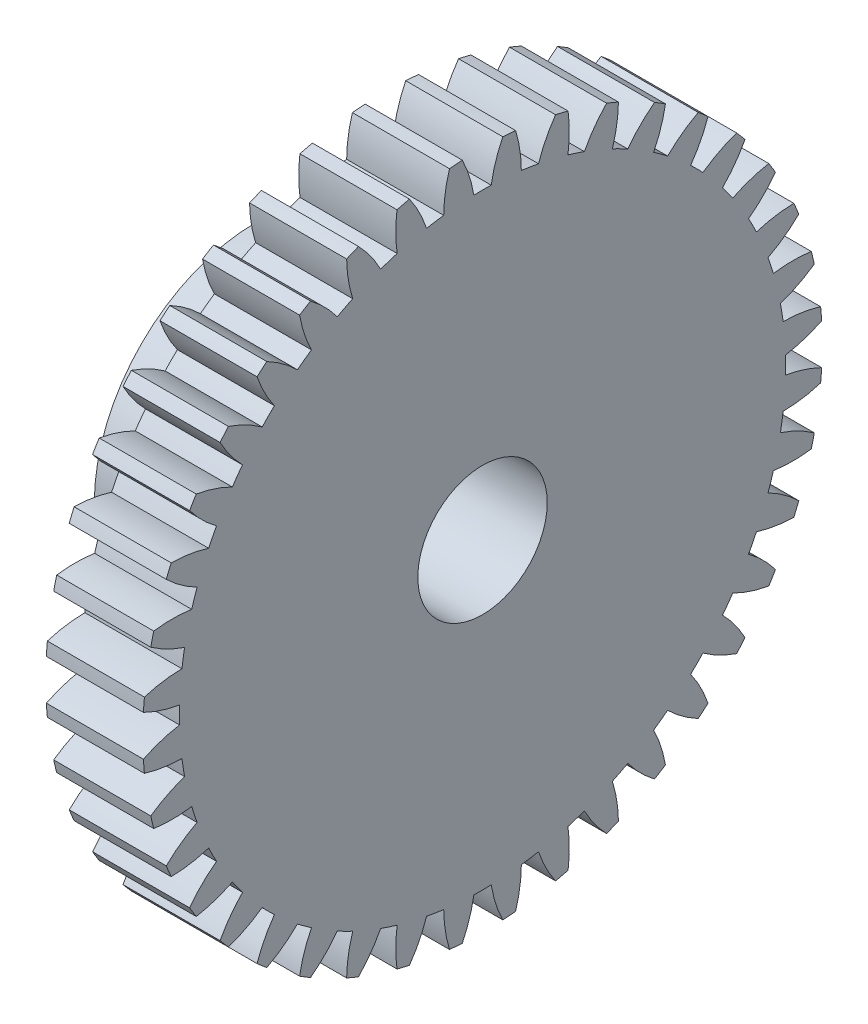
from build123d import *

# Parameters (mm, degrees)
BASPROSKE_W      = 4.7625
BASPROSKE_H      = 16.66875
TOOTHCUT_DEPTH   = 25.049446134
TEETHCUTS_COUNT  = 40
TEETHCUTS_ANGLE  = 351
HUBNEAONESKE_R   = 7.9375
HUBNEARONE_DEPTH = 11.1125
BORSKE_R         = 3.175
BORE_DEPTH       = 27.023202465


with BuildPart() as part:
    # BasProSke → Base-Revolve (revolve)
    with BuildSketch(Plane(origin=(0, 0, 0), x_dir=(1, 0, 0), z_dir=(0, 1, 0)), mode=Mode.PRIVATE) as base_revolve_sk:
        with Locations((2.38125, 8.334375)):
            Rectangle(BASPROSKE_W, BASPROSKE_H)
    revolve(base_revolve_sk.sketch.rotate(Axis((-10, 0, 0), (1, 0, 0)), 180), axis=Axis((-10, 0, 0), (1, 0, 0)))

    # TooCutSke → ToothCut (cut, through all)
    with BuildSketch(Plane(origin=(0, 0, 0), x_dir=(0, 0, -1), z_dir=(1, 0, 0))):
        with BuildLine():
            ThreePointArc((0.425632802, 14.865607879), (0, 14.8717), (-0.425632802, 14.865607879))
            ThreePointArc((-0.425632802, 14.865607879), (-0.648539099, 15.786417199), (-1.005964289, 16.663813491))
            ThreePointArc((-1.005964289, 16.663813491), (0, 16.69415), (1.005964289, 16.663813491))
            ThreePointArc((1.005964289, 16.663813491), (0.648539099, 15.786417199), (0.425632802, 14.865607879))
        make_face()
    toothcut = extrude(amount=TOOTHCUT_DEPTH, mode=Mode.SUBTRACT)

    # TeethCuts: ToothCut ×40 about axis
    teethcuts_axis = Axis((-10, 0, 0), (1, 0, 0))
    for i in range(1, TEETHCUTS_COUNT):
        add(toothcut.rotate(teethcuts_axis, i * TEETHCUTS_ANGLE / (TEETHCUTS_COUNT - 1)), mode=Mode.SUBTRACT)

    # HubNeaOneSke → HubNearOne (add)
    with BuildSketch(Plane.ZY.offset(-4.7625)):
        with Locations(Location((0, 0, 0), (0, 0, 180))):
            Circle(HUBNEAONESKE_R)
    extrude(amount=HUBNEARONE_DEPTH)

    # BorSke → Bore (cut, through all)
    with BuildSketch(Plane(origin=(4.7625, 0, 0), x_dir=(0, 0, -1), z_dir=(1, 0, 0))):
        Circle(BORSKE_R)
    extrude(amount=-BORE_DEPTH, mode=Mode.SUBTRACT)


solid = part.part
